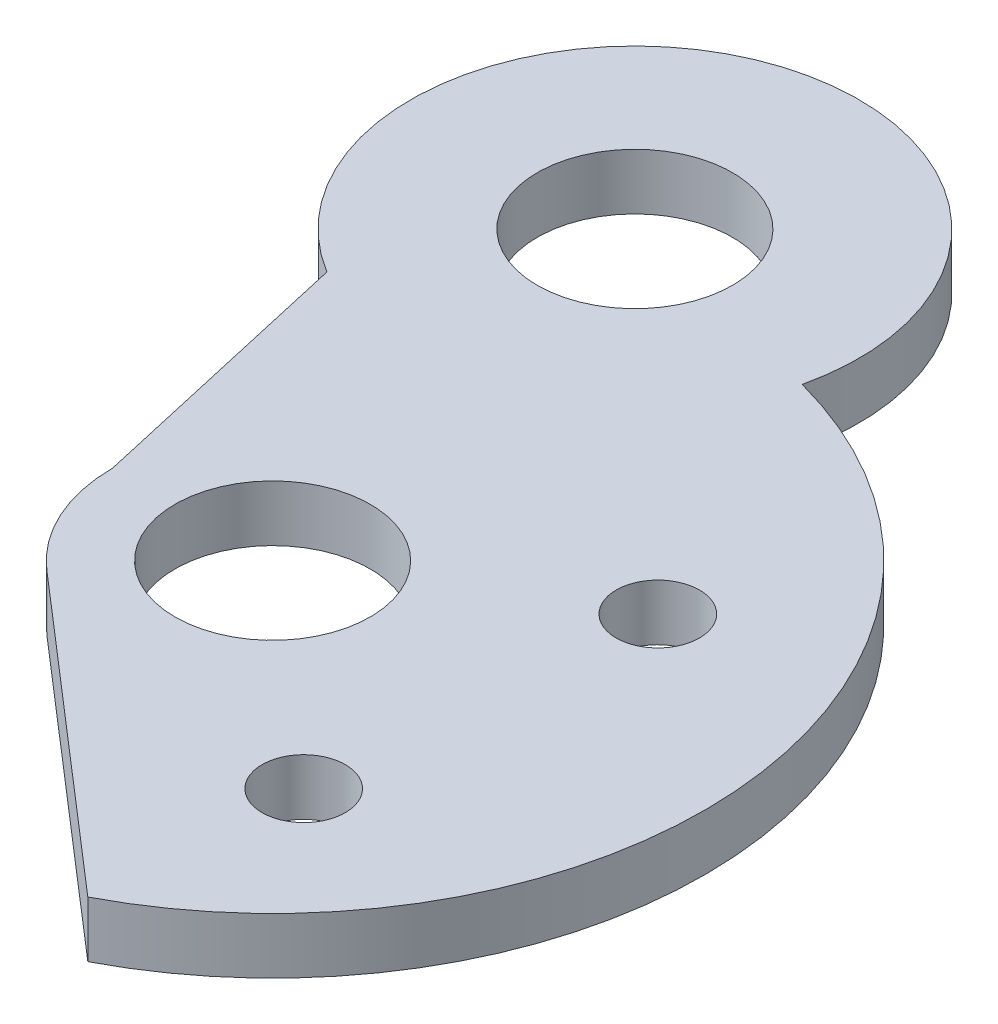
from build123d import *
from build123d.topology import SkipClean

# Parameters (mm, degrees)
SKETCH_1_R           = 27
EXTRUDE_2_DEPTH      = 10
EXTRUDE_START        = -10
EXTRUDE_3_DEPTH      = 10
CUT_EXTRUDE_2_DEPTH  = 48.669538272
SKETCH_6_R           = 6.1
CUT_EXTRUDE_3_DEPTH  = 10
EXTRUDE_5_DEPTH      = 10
SKETCH_10_R          = 6.1
CUT_EXTRUDE_5_DEPTH  = 10
CUT_EXTRUDE_START    = -10
CUT_EXTRUDE_6_DEPTH  = 10
FILLET_1_R           = 10
EXTRUDE_7_DEPTH      = 10
CUT_EXTRUDE_START_2  = -6.5
CUT_EXTRUDE_8_DEPTH  = 6.5
CUT_EXTRUDE_9_DEPTH  = 10
CUT_EXTRUDE_10_DEPTH = 10
CUT_EXTRUDE_11_DEPTH = 55.495669072


with BuildPart() as part:
    # 草图1 → 凸台-拉伸2 (new body)
    with BuildSketch(Plane(origin=(0, 0, 0), x_dir=(1, 0, 0), z_dir=(0, 1, 0))):
        with Locations(Location((0, 0, 0), (0, 0, 270))):
            Circle(SKETCH_1_R)
    extrude(amount=EXTRUDE_2_DEPTH)

    # 草图3 → 凸台-拉伸3 (add)
    with BuildSketch(Plane(origin=(0, 10, 0), x_dir=(1, 0, 0), z_dir=(0, 1, 0)).offset(EXTRUDE_START)):
        with BuildLine():
            ThreePointArc((-3.623654542, 26.755730746), (-4.775668185, 29.776890365), (-6.810627033, 32.289554959))
            ThreePointArc((-6.810627033, 32.289554959), (-7.703697007, 32.088207373), (-8.590838072, 31.862164101))
            ThreePointArc((-8.590838072, 31.862164101), (-9.263273827, 28.699511571), (-8.918147734, 25.484635391))
            ThreePointArc((-8.918147734, 25.484635391), (-6.303024824, 26.253987851), (-3.623654542, 26.755730746))
        make_face()
        with BuildLine():
            ThreePointArc((-11.714275763, 24.326441239), (-13.743495509, 26.843742988), (-16.455312443, 28.604592156))
            ThreePointArc((-16.455312443, 28.604592156), (-17.242452636, 28.137125424), (-18.016322714, 27.648003832))
            ThreePointArc((-18.016322714, 27.648003832), (-17.678533741, 24.432348458), (-16.356847947, 21.481469346))
            ThreePointArc((-16.356847947, 21.481469346), (-14.107461247, 23.021284438), (-11.714275763, 24.326441239))
        make_face()
        with BuildLine():
            ThreePointArc((-18.658222053, 19.515910171), (-21.366013737, 21.282943016), (-24.48923722, 22.119612574))
            ThreePointArc((-24.48923722, 22.119612574), (-25.093396865, 21.431785595), (-25.678244161, 20.727464312))
            ThreePointArc((-25.678244161, 20.727464312), (-24.363295599, 17.773576848), (-22.194425918, 15.375547411))
            ThreePointArc((-22.194425918, 15.375547411), (-20.530961071, 17.535097305), (-18.658222053, 19.515910171))
        make_face()
        with BuildLine():
            ThreePointArc((-23.77577157, 12.79502584), (-26.897077674, 13.638820294), (-30.125984831, 13.469411196))
            ThreePointArc((-30.125984831, 13.469411196), (-30.488024573, 12.628553268), (-30.826600159, 11.777976169))
            ThreePointArc((-30.826600159, 11.777976169), (-28.663208335, 9.3750037), (-25.859458842, 7.764559768))
            ThreePointArc((-25.859458842, 7.764559768), (-24.944747378, 10.332452674), (-23.77577157, 12.79502584))
        make_face()
        with BuildLine():
            ThreePointArc((-26.56598291, 4.821675232), (-29.795268245, 4.659634815), (-32.813791147, 3.500730003))
            ThreePointArc((-32.813791147, 3.500730003), (-32.898272013, 2.589150159), (-32.957433752, 1.675577656))
            ThreePointArc((-32.957433752, 1.675577656), (-30.15736653, 0.05873987), (-26.993187762, -0.606477084))
            ThreePointArc((-26.993187762, -0.606477084), (-26.916768011, 2.118395585), (-26.56598291, 4.821675232))
        make_face()
        with BuildLine():
            ThreePointArc((-32.289554959, -6.810627033), (-32.088207373, -7.703697007), (-31.862164101, -8.590838072))
            ThreePointArc((-31.862164101, -8.590838072), (-28.699511571, -9.263273827), (-25.484635391, -8.918147734))
            ThreePointArc((-25.484635391, -8.918147734), (-26.253987851, -6.303024824), (-26.755730746, -3.623654542))
            ThreePointArc((-26.755730746, -3.623654542), (-29.776890365, -4.775668185), (-32.289554959, -6.810627033))
        make_face()
        with BuildLine():
            ThreePointArc((-28.604592156, -16.455312443), (-28.137125424, -17.242452636), (-27.648003832, -18.016322714))
            ThreePointArc((-27.648003832, -18.016322714), (-24.432348458, -17.678533741), (-21.481469346, -16.356847947))
            ThreePointArc((-21.481469346, -16.356847947), (-23.021284438, -14.107461247), (-24.326441239, -11.714275763))
            ThreePointArc((-24.326441239, -11.714275763), (-26.843742988, -13.743495509), (-28.604592156, -16.455312443))
        make_face()
        with BuildLine():
            ThreePointArc((-22.119612574, -24.48923722), (-21.431785595, -25.093396865), (-20.727464312, -25.678244161))
            ThreePointArc((-20.727464312, -25.678244161), (-17.773576848, -24.363295599), (-15.375547411, -22.194425918))
            ThreePointArc((-15.375547411, -22.194425918), (-17.535097305, -20.530961071), (-19.515910171, -18.658222053))
            ThreePointArc((-19.515910171, -18.658222053), (-21.282943016, -21.366013737), (-22.119612574, -24.48923722))
        make_face()
        with BuildLine():
            ThreePointArc((-13.469411196, -30.125984831), (-12.628553268, -30.488024573), (-11.777976169, -30.826600159))
            ThreePointArc((-11.777976169, -30.826600159), (-9.3750037, -28.663208335), (-7.764559768, -25.859458842))
            ThreePointArc((-7.764559768, -25.859458842), (-10.332452674, -24.944747378), (-12.79502584, -23.77577157))
            ThreePointArc((-12.79502584, -23.77577157), (-13.638820294, -26.897077674), (-13.469411196, -30.125984831))
        make_face()
        with BuildLine():
            ThreePointArc((-3.500730003, -32.813791147), (-2.589150159, -32.898272013), (-1.675577656, -32.957433752))
            ThreePointArc((-1.675577656, -32.957433752), (-0.05873987, -30.15736653), (0.606477084, -26.993187762))
            ThreePointArc((0.606477084, -26.993187762), (-2.118395585, -26.916768011), (-4.821675232, -26.56598291))
            ThreePointArc((-4.821675232, -26.56598291), (-4.659634815, -29.795268245), (-3.500730003, -32.813791147))
        make_face()
        with BuildLine():
            ThreePointArc((6.810627033, -32.289554959), (7.703697007, -32.088207373), (8.590838072, -31.862164101))
            ThreePointArc((8.590838072, -31.862164101), (9.263273827, -28.699511571), (8.918147734, -25.484635391))
            ThreePointArc((8.918147734, -25.484635391), (6.303024824, -26.253987851), (3.623654542, -26.755730746))
            ThreePointArc((3.623654542, -26.755730746), (4.775668185, -29.776890365), (6.810627033, -32.289554959))
        make_face()
        with BuildLine():
            ThreePointArc((16.455312443, -28.604592156), (17.242452636, -28.137125424), (18.016322714, -27.648003832))
            ThreePointArc((18.016322714, -27.648003832), (17.678533741, -24.432348458), (16.356847947, -21.481469346))
            ThreePointArc((16.356847947, -21.481469346), (14.107461247, -23.021284438), (11.714275763, -24.326441239))
            ThreePointArc((11.714275763, -24.326441239), (13.743495509, -26.843742988), (16.455312443, -28.604592156))
        make_face()
        with BuildLine():
            ThreePointArc((24.48923722, -22.119612574), (25.093396865, -21.431785595), (25.678244161, -20.727464312))
            ThreePointArc((25.678244161, -20.727464312), (24.363295599, -17.773576848), (22.194425918, -15.375547411))
            ThreePointArc((22.194425918, -15.375547411), (20.530961071, -17.535097305), (18.658222053, -19.515910171))
            ThreePointArc((18.658222053, -19.515910171), (21.366013737, -21.282943016), (24.48923722, -22.119612574))
        make_face()
        with BuildLine():
            ThreePointArc((30.125984831, -13.469411196), (30.488024573, -12.628553268), (30.826600159, -11.777976169))
            ThreePointArc((30.826600159, -11.777976169), (28.663208335, -9.3750037), (25.859458842, -7.764559768))
            ThreePointArc((25.859458842, -7.764559768), (24.944747378, -10.332452674), (23.77577157, -12.79502584))
            ThreePointArc((23.77577157, -12.79502584), (26.897077674, -13.638820294), (30.125984831, -13.469411196))
        make_face()
        with BuildLine():
            ThreePointArc((32.813791147, -3.500730003), (32.898272013, -2.589150159), (32.957433752, -1.675577656))
            ThreePointArc((32.957433752, -1.675577656), (30.15736653, -0.05873987), (26.993187762, 0.606477084))
            ThreePointArc((26.993187762, 0.606477084), (26.998296887, 0.303257671), (27, 0))
            ThreePointArc((27, 0), (26.891276825, -2.420584789), (26.56598291, -4.821675232))
            ThreePointArc((26.56598291, -4.821675232), (29.795268245, -4.659634815), (32.813791147, -3.500730003))
        make_face()
        with BuildLine():
            ThreePointArc((26.755730746, 3.623654542), (29.776890365, 4.775668185), (32.289554959, 6.810627033))
            ThreePointArc((32.289554959, 6.810627033), (32.088207373, 7.703697007), (31.862164101, 8.590838072))
            ThreePointArc((31.862164101, 8.590838072), (28.699511571, 9.263273827), (25.484635391, 8.918147734))
            ThreePointArc((25.484635391, 8.918147734), (26.253987851, 6.303024824), (26.755730746, 3.623654542))
        make_face()
        with BuildLine():
            ThreePointArc((24.326441239, 11.714275763), (26.843742988, 13.743495509), (28.604592156, 16.455312443))
            ThreePointArc((28.604592156, 16.455312443), (28.137125424, 17.242452636), (27.648003832, 18.016322714))
            ThreePointArc((27.648003832, 18.016322714), (24.432348458, 17.678533741), (21.481469346, 16.356847947))
            ThreePointArc((21.481469346, 16.356847947), (23.021284438, 14.107461247), (24.326441239, 11.714275763))
        make_face()
        with BuildLine():
            ThreePointArc((19.515910171, 18.658222053), (21.282943016, 21.366013737), (22.119612574, 24.48923722))
            ThreePointArc((22.119612574, 24.48923722), (21.431785595, 25.093396865), (20.727464312, 25.678244161))
            ThreePointArc((20.727464312, 25.678244161), (17.773576848, 24.363295599), (15.375547411, 22.194425918))
            ThreePointArc((15.375547411, 22.194425918), (17.535097305, 20.530961071), (19.515910171, 18.658222053))
        make_face()
        with BuildLine():
            ThreePointArc((12.79502584, 23.77577157), (13.638820294, 26.897077674), (13.469411196, 30.125984831))
            ThreePointArc((13.469411196, 30.125984831), (12.628553268, 30.488024573), (11.777976169, 30.826600159))
            ThreePointArc((11.777976169, 30.826600159), (9.3750037, 28.663208335), (7.764559768, 25.859458842))
            ThreePointArc((7.764559768, 25.859458842), (10.332452674, 24.944747378), (12.79502584, 23.77577157))
        make_face()
        with BuildLine():
            ThreePointArc((4.821675232, 26.56598291), (4.659634815, 29.795268245), (3.500730003, 32.813791147))
            ThreePointArc((3.500730003, 32.813791147), (2.589150159, 32.898272013), (1.675577656, 32.957433752))
            ThreePointArc((1.675577656, 32.957433752), (0.05873987, 30.15736653), (-0.606477084, 26.993187762))
            ThreePointArc((-0.606477084, 26.993187762), (2.118395585, 26.916768011), (4.821675232, 26.56598291))
        make_face()
    extrude(amount=EXTRUDE_3_DEPTH)

    # 草图4 → 切除-拉伸2 (cut, through all)
    with BuildSketch(Plane(origin=(0, 10, 0), x_dir=(1, 0, 0), z_dir=(0, 1, 0))):
        with BuildLine():
            Line((68.70942434, -72.656830422), (-6.542169106, -7.563069707))
            ThreePointArc((-6.542169106, -7.563069707), (-9.614988938, -2.748088014), (-9.550796477, 2.963492306))
            Line((-9.550796477, 2.963492306), (-2.118395585, 26.916768011))
            Line((-2.118395585, 26.916768011), (19.935579671, 97.992717399))
            ThreePointArc((19.935579671, 97.992717399), (-96.149889375, -27.480880138), (68.70942434, -72.656830422))
        make_face()
    extrude(amount=-CUT_EXTRUDE_2_DEPTH, mode=Mode.SUBTRACT)

    # 草图6 → 切除-拉伸3 (cut)
    with BuildSketch(Plane(origin=(0, 10, 0), x_dir=(1, 0, 0), z_dir=(0, 1, 0))):
        with Locations(Location((0, 0, 0), (0, 0, 270))):
            Circle(SKETCH_6_R)
    extrude(amount=-CUT_EXTRUDE_3_DEPTH, mode=Mode.SUBTRACT)

    # 草图9 → 凸台-拉伸5 (add)
    with BuildSketch(Plane(origin=(0, 10, 0), x_dir=(1, 0, 0), z_dir=(0, 1, 0)).offset(EXTRUDE_START)):
        with BuildLine():
            Line((-18.337271569, 36.810995995), (-10, 0))
            ThreePointArc((-10, 0), (-9.887061363, 1.49867195), (-9.550796477, 2.963492306))
            Line((-9.550796477, 2.963492306), (-2.118395585, 26.916768011))
            ThreePointArc((-2.118395585, 26.916768011), (-1.362972032, 26.965576338), (-0.606477084, 26.993187762))
            ThreePointArc((-0.606477084, 26.993187762), (0.05873987, 30.15736653), (1.675577656, 32.957433752))
            ThreePointArc((1.675577656, 32.957433752), (2.589150159, 32.898272013), (3.500730003, 32.813791147))
            ThreePointArc((3.500730003, 32.813791147), (4.659634815, 29.795268245), (4.821675232, 26.56598291))
            Line((4.821675232, 26.56598291), (7.168022985, 33.612773021))
            ThreePointArc((7.168022985, 33.612773021), (-5.303969741, 37.450057719), (-18.337271569, 36.810995995))
        make_face()
    extrude(amount=EXTRUDE_5_DEPTH)

    # 草图10 → 切除-拉伸5 (cut)
    with BuildSketch(Plane(origin=(0, 10, 0), x_dir=(1, 0, 0), z_dir=(0, 1, 0))):
        with Locations(Location((-6.626815852, 29.258935587, 0), (0, 0, 270))):
            Circle(SKETCH_10_R)
    extrude(amount=-CUT_EXTRUDE_5_DEPTH, mode=Mode.SUBTRACT)

    # 草图11 → 切除-拉伸6 (cut)
    with BuildSketch(Plane(origin=(0, 10, 0), x_dir=(1, 0, 0), z_dir=(0, 1, 0)).offset(CUT_EXTRUDE_START)):
        with BuildLine():
            Line((0, 36.394498532), (3.500730003, 32.813791147))
            ThreePointArc((3.500730003, 32.813791147), (4.659634815, 29.795268245), (4.821675232, 26.56598291))
            Line((4.821675232, 26.56598291), (7.168022985, 33.612773021))
            ThreePointArc((7.168022985, 33.612773021), (3.655030847, 35.186640305), (0, 36.394498532))
        make_face()
    extrude(amount=CUT_EXTRUDE_6_DEPTH, mode=Mode.SUBTRACT)

    # 圆角1
    fillet_1_edges = [part.edges().sort_by_distance(p)[0] for p in [
        (-18.337271569, 5, -36.810995995),
    ]]
    fillet(fillet_1_edges, radius=FILLET_1_R)

    # 草图16 → 凸台-拉伸7 (add)
    with BuildSketch(Plane(origin=(0, 10, 0), x_dir=(1, 0, 0), z_dir=(0, 1, 0)).offset(EXTRUDE_START)):
        with BuildLine():
            Line((-13.920244702, 17.308793512), (-15.716384779, 25.239170332))
            ThreePointArc((-15.716384779, 25.239170332), (-13.300434171, 34.242814336), (-4.508428545, 37.341694744))
            ThreePointArc((-4.508428545, 37.341694744), (-2.23974925, 36.936946702), (0, 36.394498532))
            Line((0, 36.394498532), (3.500730003, 32.813791147))
            ThreePointArc((3.500730003, 32.813791147), (4.659634815, 29.795268245), (4.821675232, 26.56598291))
            ThreePointArc((4.821675232, 26.56598291), (5.919103569, 26.343200507), (7.006350229, 26.075104151))
            ThreePointArc((7.006350229, 26.075104151), (7.281173311, 27.65648826), (7.373184148, 29.258935587))
            ThreePointArc((7.373184148, 29.258935587), (-13.478530824, 41.467703008), (-13.920244702, 17.308793512))
        make_face()
    extrude(amount=EXTRUDE_7_DEPTH)

    # 草图17 → 切除-拉伸8 (cut)
    with BuildSketch(Plane(origin=(0, 10, 0), x_dir=(1, 0, 0), z_dir=(0, 1, 0)).offset(CUT_EXTRUDE_START_2)):
        with BuildLine():
            Line((-13.920244702, 17.308793512), (-10, 0))
            ThreePointArc((-10, 0), (-9.09455032, -4.158022904), (-6.542169106, -7.563069707))
            Line((-6.542169106, -7.563069707), (17.242452636, -28.137125424))
            ThreePointArc((17.242452636, -28.137125424), (17.631083908, -27.895248345), (18.016322714, -27.648003832))
            ThreePointArc((18.016322714, -27.648003832), (17.678533741, -24.432348458), (16.356847947, -21.481469346))
            ThreePointArc((16.356847947, -21.481469346), (17.535097305, -20.530961071), (18.658222053, -19.515910171))
            ThreePointArc((18.658222053, -19.515910171), (21.366013737, -21.282943016), (24.48923722, -22.119612574))
            ThreePointArc((24.48923722, -22.119612574), (25.093396865, -21.431785595), (25.678244161, -20.727464312))
            ThreePointArc((25.678244161, -20.727464312), (24.363295599, -17.773576848), (22.194425918, -15.375547411))
            ThreePointArc((22.194425918, -15.375547411), (23.021284438, -14.107461247), (23.77577157, -12.79502584))
            ThreePointArc((23.77577157, -12.79502584), (26.897077674, -13.638820294), (30.125984831, -13.469411196))
            ThreePointArc((30.125984831, -13.469411196), (30.488024573, -12.628553268), (30.826600159, -11.777976169))
            ThreePointArc((30.826600159, -11.777976169), (28.663208335, -9.3750037), (25.859458842, -7.764559768))
            ThreePointArc((25.859458842, -7.764559768), (26.253987851, -6.303024824), (26.56598291, -4.821675232))
            ThreePointArc((26.56598291, -4.821675232), (29.795268245, -4.659634815), (32.813791147, -3.500730003))
            ThreePointArc((32.813791147, -3.500730003), (32.898272013, -2.589150159), (32.957433752, -1.675577656))
            ThreePointArc((32.957433752, -1.675577656), (30.15736653, -0.05873987), (26.993187762, 0.606477084))
            ThreePointArc((26.993187762, 0.606477084), (26.916768011, 2.118395585), (26.755730746, 3.623654542))
            ThreePointArc((26.755730746, 3.623654542), (29.776890365, 4.775668185), (32.289554959, 6.810627033))
            ThreePointArc((32.289554959, 6.810627033), (32.088207373, 7.703697007), (31.862164101, 8.590838072))
            ThreePointArc((31.862164101, 8.590838072), (28.699511571, 9.263273827), (25.484635391, 8.918147734))
            ThreePointArc((25.484635391, 8.918147734), (24.944747378, 10.332452674), (24.326441239, 11.714275763))
            ThreePointArc((24.326441239, 11.714275763), (26.843742988, 13.743495509), (28.604592156, 16.455312443))
            ThreePointArc((28.604592156, 16.455312443), (28.137125424, 17.242452636), (27.648003832, 18.016322714))
            ThreePointArc((27.648003832, 18.016322714), (24.432348458, 17.678533741), (21.481469346, 16.356847947))
            ThreePointArc((21.481469346, 16.356847947), (20.530961071, 17.535097305), (19.515910171, 18.658222053))
            ThreePointArc((19.515910171, 18.658222053), (21.282943016, 21.366013737), (22.119612574, 24.48923722))
            ThreePointArc((22.119612574, 24.48923722), (21.431785595, 25.093396865), (20.727464312, 25.678244161))
            ThreePointArc((20.727464312, 25.678244161), (17.773576848, 24.363295599), (15.375547411, 22.194425918))
            ThreePointArc((15.375547411, 22.194425918), (14.107461247, 23.021284438), (12.79502584, 23.77577157))
            ThreePointArc((12.79502584, 23.77577157), (13.638820294, 26.897077674), (13.469411196, 30.125984831))
            ThreePointArc((13.469411196, 30.125984831), (12.628553268, 30.488024573), (11.777976169, 30.826600159))
            ThreePointArc((11.777976169, 30.826600159), (9.3750037, 28.663208335), (7.764559768, 25.859458842))
            ThreePointArc((7.764559768, 25.859458842), (7.386242025, 25.970048686), (7.006350229, 26.075104151))
            ThreePointArc((7.006350229, 26.075104151), (-12.036078056, 42.171715396), (-13.920244702, 17.308793512))
        make_face()
    extrude(amount=CUT_EXTRUDE_8_DEPTH, mode=Mode.SUBTRACT)

    # 草图19 → 切除-拉伸9 (cut)
    with BuildSketch(Plane(origin=(0, 3.5, 0), x_dir=(1, 0, 0), z_dir=(0, 1, 0))):
        with BuildLine():
            ThreePointArc((17.521202876, 9.143724883), (17.423586491, 9.849470052), (17.138067304, 10.502221151))
            Line((17.138067304, 10.502221151), (14.921202876, 9.143724883))
            ThreePointArc((14.921202876, 9.143724883), (15.559223715, 8.01002855), (16.111264261, 6.832068788))
            ThreePointArc((16.111264261, 6.832068788), (17.140905514, 7.78987105), (17.521202876, 9.143724883))
        make_face()
        with BuildLine():
            Line((14.921202876, 9.143724883), (17.138067304, 10.502221151))
            ThreePointArc((17.138067304, 10.502221151), (15.433773338, 11.692699485), (13.401778777, 11.253547246))
            ThreePointArc((13.401778777, 11.253547246), (14.200727447, 10.226892977), (14.921202876, 9.143724883))
        make_face()
        with BuildLine():
            ThreePointArc((16.111264261, 6.832068788), (15.559223715, 8.01002855), (14.921202876, 9.143724883))
            Line((14.921202876, 9.143724883), (12.704338449, 7.785228614))
            ThreePointArc((12.704338449, 7.785228614), (14.220696248, 6.639869762), (16.111264261, 6.832068788))
        make_face()
        with BuildLine():
            Line((12.704338449, 7.785228614), (14.921202876, 9.143724883))
            ThreePointArc((14.921202876, 9.143724883), (14.200727447, 10.226892977), (13.401778777, 11.253547246))
            ThreePointArc((13.401778777, 11.253547246), (12.372228274, 9.656295344), (12.704338449, 7.785228614))
        make_face()
        with BuildLine():
            ThreePointArc((11.330048887, -9.67677592), (10.709328217, -11.472853236), (11.476337998, -13.211497499))
            ThreePointArc((11.476337998, -13.211497499), (12.426054396, -12.322466156), (13.307104398, -11.365340846))
            Line((13.307104398, -11.365340846), (11.330048887, -9.67677592))
        make_face()
        with BuildLine():
            ThreePointArc((13.307104398, -11.365340846), (12.426054396, -12.322466156), (11.476337998, -13.211497499))
            ThreePointArc((11.476337998, -13.211497499), (13.414616788, -13.963117027), (15.284159909, -13.053905771))
            Line((15.284159909, -13.053905771), (13.307104398, -11.365340846))
        make_face()
        with BuildLine():
            ThreePointArc((14.844136837, -9.268311689), (13.006911405, -8.782728957), (11.330048887, -9.67677592))
            Line((11.330048887, -9.67677592), (13.307104398, -11.365340846))
            ThreePointArc((13.307104398, -11.365340846), (14.114619321, -10.345410645), (14.844136837, -9.268311689))
        make_face()
        with BuildLine():
            ThreePointArc((15.907104398, -11.365340846), (15.626186581, -10.189816354), (14.844136837, -9.268311689))
            ThreePointArc((14.844136837, -9.268311689), (14.114619321, -10.345410645), (13.307104398, -11.365340846))
            Line((13.307104398, -11.365340846), (15.284159909, -13.053905771))
            ThreePointArc((15.284159909, -13.053905771), (15.746401871, -12.265245194), (15.907104398, -11.365340846))
        make_face()
    extrude(amount=-CUT_EXTRUDE_9_DEPTH, mode=Mode.SUBTRACT)

    # 草图20 → 切除-拉伸10 (cut)
    with SkipClean():  # the faces are left unmerged after this step: merging them gives an invalid solid
        with BuildSketch(Plane(origin=(0, 3.5, 0), x_dir=(1, 0, 0), z_dir=(0, 1, 0)).offset(CUT_EXTRUDE_START)):
            with BuildLine():
                ThreePointArc((11.777976169, 30.826600159), (9.3750037, 28.663208335), (7.764559768, 25.859458842))
                ThreePointArc((7.764559768, 25.859458842), (10.332452674, 24.944747378), (12.79502584, 23.77577157))
                ThreePointArc((12.79502584, 23.77577157), (13.638820294, 26.897077674), (13.469411196, 30.125984831))
                ThreePointArc((13.469411196, 30.125984831), (12.628553268, 30.488024573), (11.777976169, 30.826600159))
            make_face()
        extrude(amount=CUT_EXTRUDE_10_DEPTH, mode=Mode.SUBTRACT)

    # 草图22 → 切除-拉伸11 (cut, through all)
    with SkipClean():  # the faces are left unmerged after this step: merging them gives an invalid solid
        with BuildSketch(Plane(origin=(0, 3.5, 0), x_dir=(1, 0, 0), z_dir=(0, 1, 0))):
            with BuildLine():
                ThreePointArc((20.727464312, 25.678244161), (17.773576848, 24.363295599), (15.375547411, 22.194425918))
                ThreePointArc((15.375547411, 22.194425918), (17.535097305, 20.530961071), (19.515910171, 18.658222053))
                ThreePointArc((19.515910171, 18.658222053), (21.282943016, 21.366013737), (22.119612574, 24.48923722))
                ThreePointArc((22.119612574, 24.48923722), (21.431785595, 25.093396865), (20.727464312, 25.678244161))
            make_face()
            with BuildLine():
                ThreePointArc((27.648003832, 18.016322714), (24.432348458, 17.678533741), (21.481469346, 16.356847947))
                ThreePointArc((21.481469346, 16.356847947), (23.021284438, 14.107461247), (24.326441239, 11.714275763))
                ThreePointArc((24.326441239, 11.714275763), (26.843742988, 13.743495509), (28.604592156, 16.455312443))
                ThreePointArc((28.604592156, 16.455312443), (28.137125424, 17.242452636), (27.648003832, 18.016322714))
            make_face()
            with BuildLine():
                ThreePointArc((31.862164101, 8.590838072), (28.699511571, 9.263273827), (25.484635391, 8.918147734))
                ThreePointArc((25.484635391, 8.918147734), (26.253987851, 6.303024824), (26.755730746, 3.623654542))
                ThreePointArc((26.755730746, 3.623654542), (29.776890365, 4.775668185), (32.289554959, 6.810627033))
                ThreePointArc((32.289554959, 6.810627033), (32.088207373, 7.703697007), (31.862164101, 8.590838072))
            make_face()
            with BuildLine():
                ThreePointArc((27, 0), (26.891276825, -2.420584789), (26.56598291, -4.821675232))
                ThreePointArc((26.56598291, -4.821675232), (29.795268245, -4.659634815), (32.813791147, -3.500730003))
                ThreePointArc((32.813791147, -3.500730003), (32.898272013, -2.589150159), (32.957433752, -1.675577656))
                ThreePointArc((32.957433752, -1.675577656), (30.15736653, -0.05873987), (26.993187762, 0.606477084))
                ThreePointArc((26.993187762, 0.606477084), (26.998296887, 0.303257671), (27, 0))
            make_face()
            with BuildLine():
                ThreePointArc((25.859458842, -7.764559768), (24.944747378, -10.332452674), (23.77577157, -12.79502584))
                ThreePointArc((23.77577157, -12.79502584), (26.897077674, -13.638820294), (30.125984831, -13.469411196))
                ThreePointArc((30.125984831, -13.469411196), (30.488024573, -12.628553268), (30.826600159, -11.777976169))
                ThreePointArc((30.826600159, -11.777976169), (28.663208335, -9.3750037), (25.859458842, -7.764559768))
            make_face()
            with BuildLine():
                ThreePointArc((22.194425918, -15.375547411), (20.530961071, -17.535097305), (18.658222053, -19.515910171))
                ThreePointArc((18.658222053, -19.515910171), (21.366013737, -21.282943016), (24.48923722, -22.119612574))
                ThreePointArc((24.48923722, -22.119612574), (25.093396865, -21.431785595), (25.678244161, -20.727464312))
                ThreePointArc((25.678244161, -20.727464312), (24.363295599, -17.773576848), (22.194425918, -15.375547411))
            make_face()
            with BuildLine():
                ThreePointArc((16.356847947, -21.481469346), (14.445101596, -22.810941232), (12.425913221, -23.970746351))
                Line((12.425913221, -23.970746351), (17.242452636, -28.137125424))
                ThreePointArc((17.242452636, -28.137125424), (17.631083908, -27.895248345), (18.016322714, -27.648003832))
                ThreePointArc((18.016322714, -27.648003832), (17.678533741, -24.432348458), (16.356847947, -21.481469346))
            make_face()
        extrude(amount=-CUT_EXTRUDE_11_DEPTH, mode=Mode.SUBTRACT)


solid = part.part
